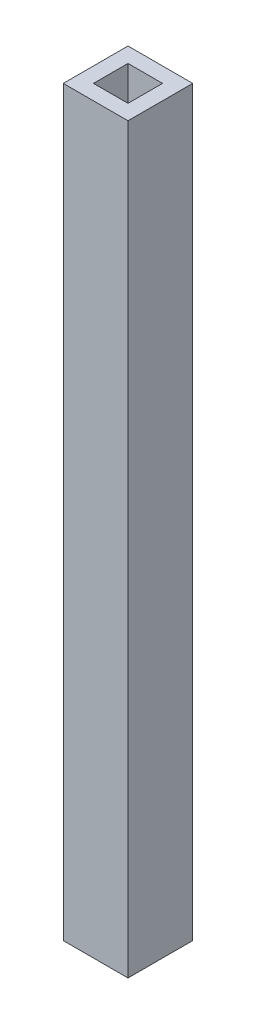
from build123d import *

# Parameters (mm, degrees)
SKETCH1_W           = 150
SKETCH1_H           = 150
SKETCH1_W_2         = 80
SKETCH1_H_2         = 80
BOSS_EXTRUDE1_DEPTH = 1720


with BuildPart() as part:
    # Sketch1 → Boss-Extrude1 (new body)
    with BuildSketch(Plane(origin=(0, 0, 0), x_dir=(1, 0, 0), z_dir=(0, 1, 0))):
        Rectangle(SKETCH1_W, SKETCH1_H)
        Rectangle(SKETCH1_W_2, SKETCH1_H_2, mode=Mode.SUBTRACT)
    extrude(amount=BOSS_EXTRUDE1_DEPTH)


solid = part.part
